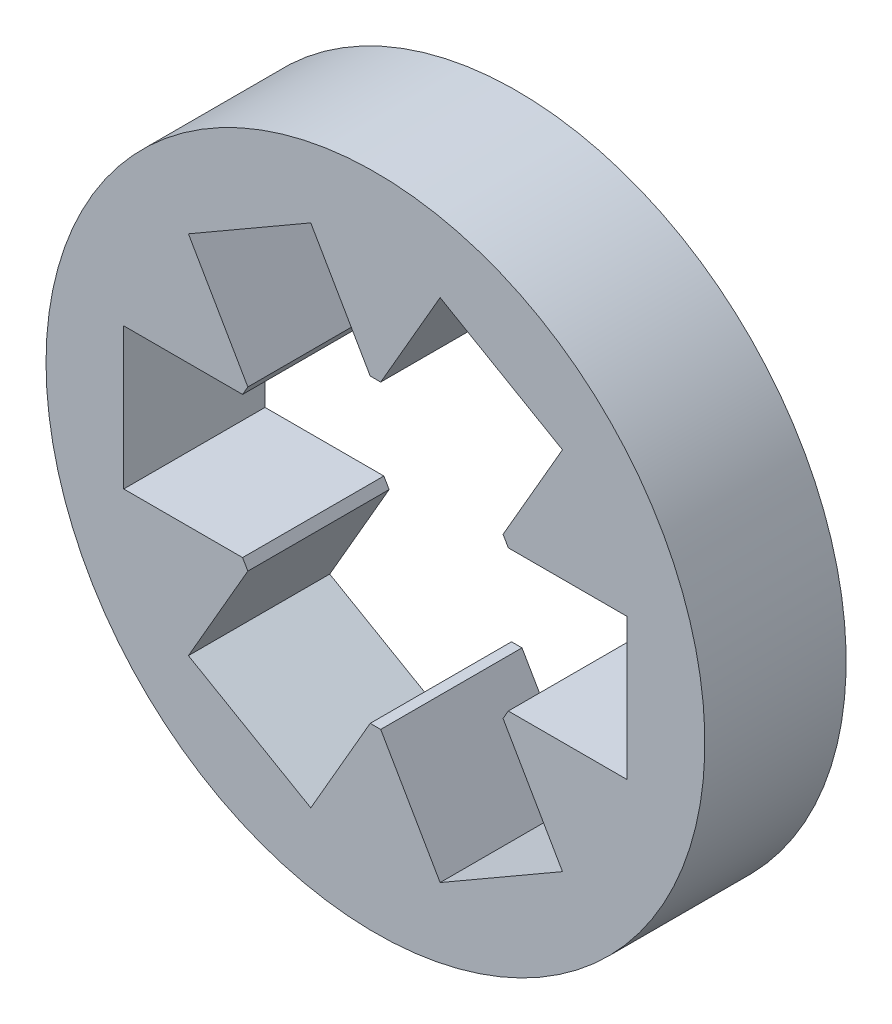
from build123d import *

# Parameters (mm, degrees)
SKETCH1_R           = 3.553520767
BOSS_EXTRUDE1_DEPTH = 1.524


with BuildPart() as part:
    # Sketch1 → Boss-Extrude1 (new body)
    with BuildSketch(Plane.XY):
        with Locations(Location((107.492585866, -0.762, 0), (0, 0, 180))):
            Circle(SKETCH1_R)
        Polygon((110.207675722, 0), (110.207675722, -1.524), (108.925853356, -1.524), (108.869130969, -1.622246056), (109.510042152, -2.732336789), (108.190219437, -3.494336789), (107.549308253, -2.384246056), (107.435863479, -2.384246056), (106.794952296, -3.494336789), (105.47512958, -2.732336789), (106.116040764, -1.622246056), (106.059318377, -1.524), (104.77749601, -1.524), (104.77749601, 0), (106.059318377, 0), (106.116040764, 0.098246056), (105.47512958, 1.208336789), (106.794952296, 1.970336789), (107.435863479, 0.860246056), (107.549308253, 0.860246056), (108.190219437, 1.970336789), (109.510042152, 1.208336789), (108.869130969, 0.098246056), (108.925853356, 0), align=None, mode=Mode.SUBTRACT)
    extrude(amount=BOSS_EXTRUDE1_DEPTH)


solid = part.part
